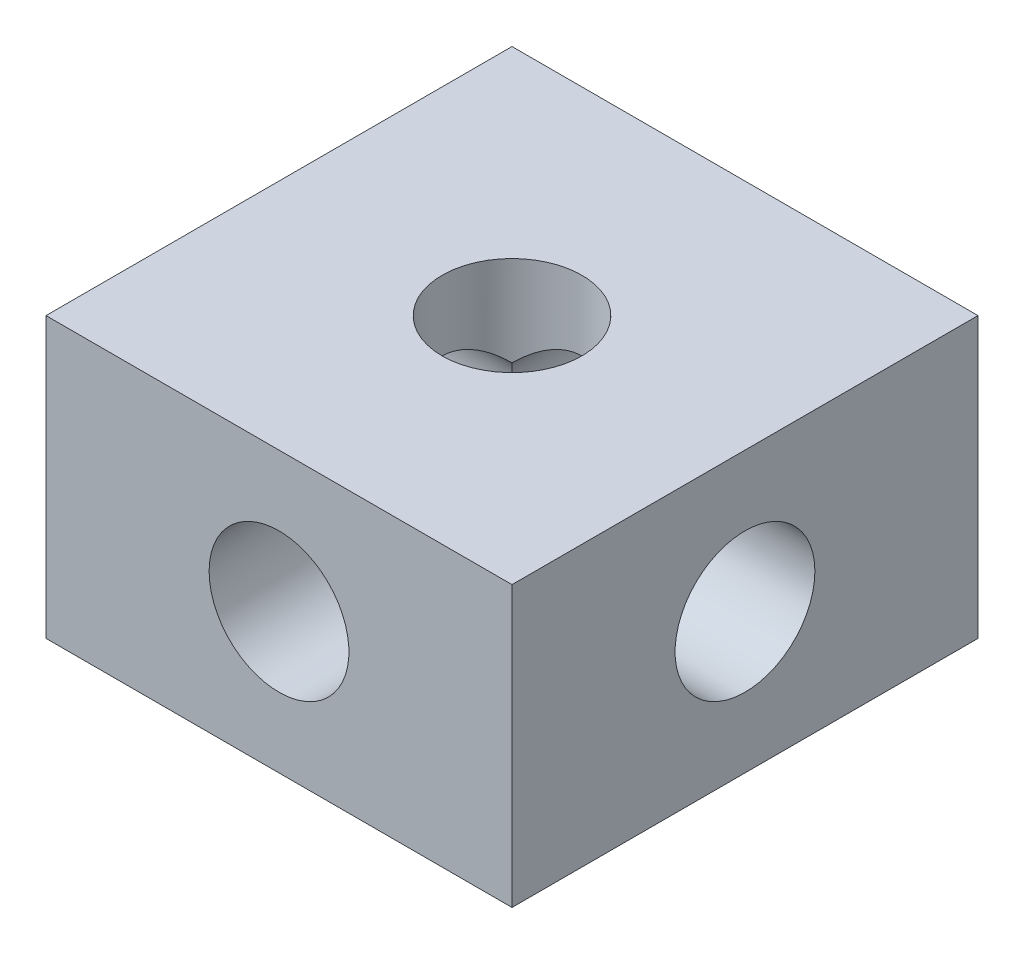
from build123d import *

# Parameters (mm, degrees)
SKETCH_1_W          = 10
SKETCH_1_H          = 10
SKETCH_1_R          = 1.5
EXTRUDE_1_DEPTH     = 6
SKETCH_2_R          = 1.5
CUT_EXTRUDE_1_DEPTH = 10
SKETCH_3_R          = 1.5
CUT_EXTRUDE_2_DEPTH = 10


with BuildPart() as part:
    # 草图1 → 凸台-拉伸1 (new body)
    with BuildSketch(Plane(origin=(0, 0, 0), x_dir=(1, 0, 0), z_dir=(0, 1, 0))):
        Rectangle(SKETCH_1_W, SKETCH_1_H)
        with Locations(Location((0, 0, 0), (0, 0, 270))):
            Circle(SKETCH_1_R, mode=Mode.SUBTRACT)
    extrude(amount=EXTRUDE_1_DEPTH)

    # 草图2 → 切除-拉伸1 (cut)
    with BuildSketch(Plane(origin=(0, 0, -5), x_dir=(-1, 0, 0), z_dir=(0, 0, -1))):
        with Locations((0, 3)):
            Circle(SKETCH_2_R)
    extrude(amount=-CUT_EXTRUDE_1_DEPTH, mode=Mode.SUBTRACT)

    # 草图3 → 切除-拉伸2 (cut)
    with BuildSketch(Plane(origin=(5, 0, 0), x_dir=(0, 0, -1), z_dir=(1, 0, 0))):
        with Locations((0, 3)):
            Circle(SKETCH_3_R)
    extrude(amount=-CUT_EXTRUDE_2_DEPTH, mode=Mode.SUBTRACT)


solid = part.part
